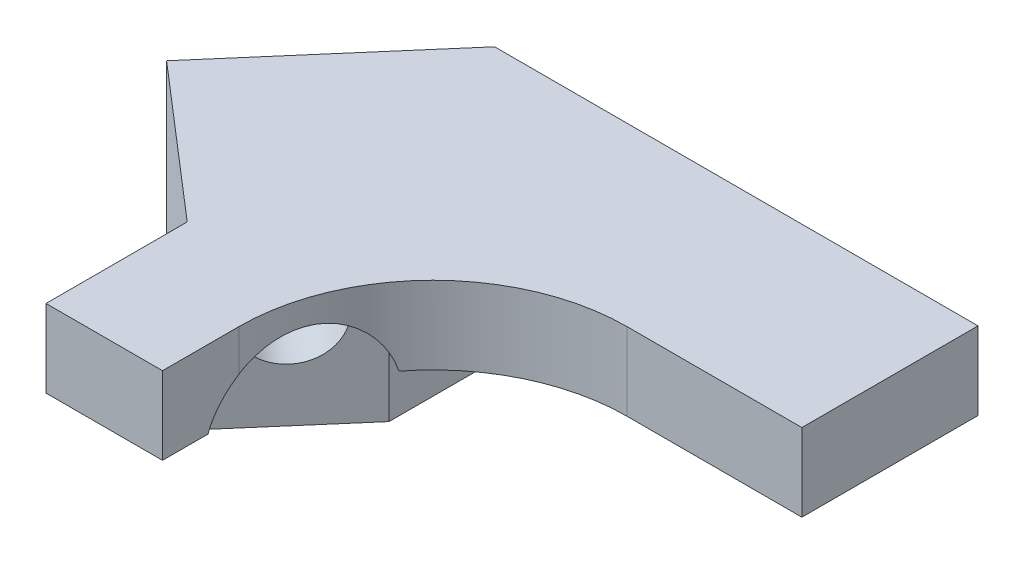
from build123d import *

# Parameters (mm, degrees)
BOSS_EXTRUDE1_DEPTH = 4
BOSS_EXTRUDE2_DEPTH = 6
SKETCH4_R           = 2.25
CUT_EXTRUDE1_DEPTH  = 36.318797722
CUT_EXTRUDE2_REACH  = 28.63
SKETCH5_R           = 3.75
FILLET1_R           = 10
FILLET3_R           = 2


with BuildPart() as part:
    # Sketch2 → Boss-Extrude1 (new body)
    with BuildSketch(Plane(origin=(0, 0, 0), x_dir=(1, 0, 0), z_dir=(0, 1, 0))):
        Polygon((-32.718226242, 13.928959815), (-24.894958744, 23), (0, 23), (0, 13.928959815), (-19, 13.928959815), (-19, 0), (-25, 0), (-25, 7.27241908), align=None)
    extrude(amount=-BOSS_EXTRUDE1_DEPTH)

    # Sketch3 → Boss-Extrude2 (add)
    with BuildSketch(Plane(origin=(0, -4, 0), x_dir=(-1, 0, 0), z_dir=(0, 1, 0))):
        Polygon((25.757269356, -7.92552177), (32.718226242, -13.928959815), (24.894958744, -23), (20.894958744, -23), (20.894958744, -13.563347009), align=None)
    extrude(amount=-BOSS_EXTRUDE2_DEPTH)

    # Sketch4 → Cut-Extrude1 (cut, through all)
    with BuildSketch(Plane(origin=(-25.651402317, 0, -22.122907398), x_dir=(-0.653102689208867, 0, 0.7572693558755339), z_dir=(-0.7572693558755339, 0, -0.653102689208867))):
        with Locations((7.020387118, -5)):
            Circle(SKETCH4_R)
    extrude(amount=-CUT_EXTRUDE1_DEPTH, mode=Mode.SUBTRACT)

    # Cut-Extrude2: up to this plane
    cut_extrude2_end = Plane(origin=(-19, -4, -13.928959815), z_dir=(1, 0, 0))
    # Sketch5 → Cut-Extrude2 (cut, up to the surface)
    with BuildSketch(Plane(origin=(-18.690445431, 0, -16.119469352), x_dir=(0.6531026892088669, 0, -0.757269355875534), z_dir=(0.757269355875534, 0, 0.6531026892088669)), mode=Mode.PRIVATE) as cut_extrude2_sk1:
        with Locations((-7.020387118, -5)):
            Circle(SKETCH5_R)
    cut_extrude2_tool1 = split(extrude(cut_extrude2_sk1.sketch, amount=CUT_EXTRUDE2_REACH, mode=Mode.PRIVATE), bisect_by=cut_extrude2_end, keep=Keep.BOTH, mode=Mode.PRIVATE)
    add(cut_extrude2_tool1.solids().sort_by_distance((-23.275479, -5, -10.803145))[0], mode=Mode.SUBTRACT)

    # Fillet1
    fillet1_edges = [part.edges().sort_by_distance(p)[0] for p in [
        (-19, -2, -13.928959815),
    ]]
    fillet(fillet1_edges, radius=FILLET1_R)

    # Fillet3
    fillet3_edges = [part.edges().sort_by_distance(p)[0] for p in [
        (-20.894958744, -4, -18.281673505),
    ]]
    fillet(fillet3_edges, radius=FILLET3_R)


solid = part.part
